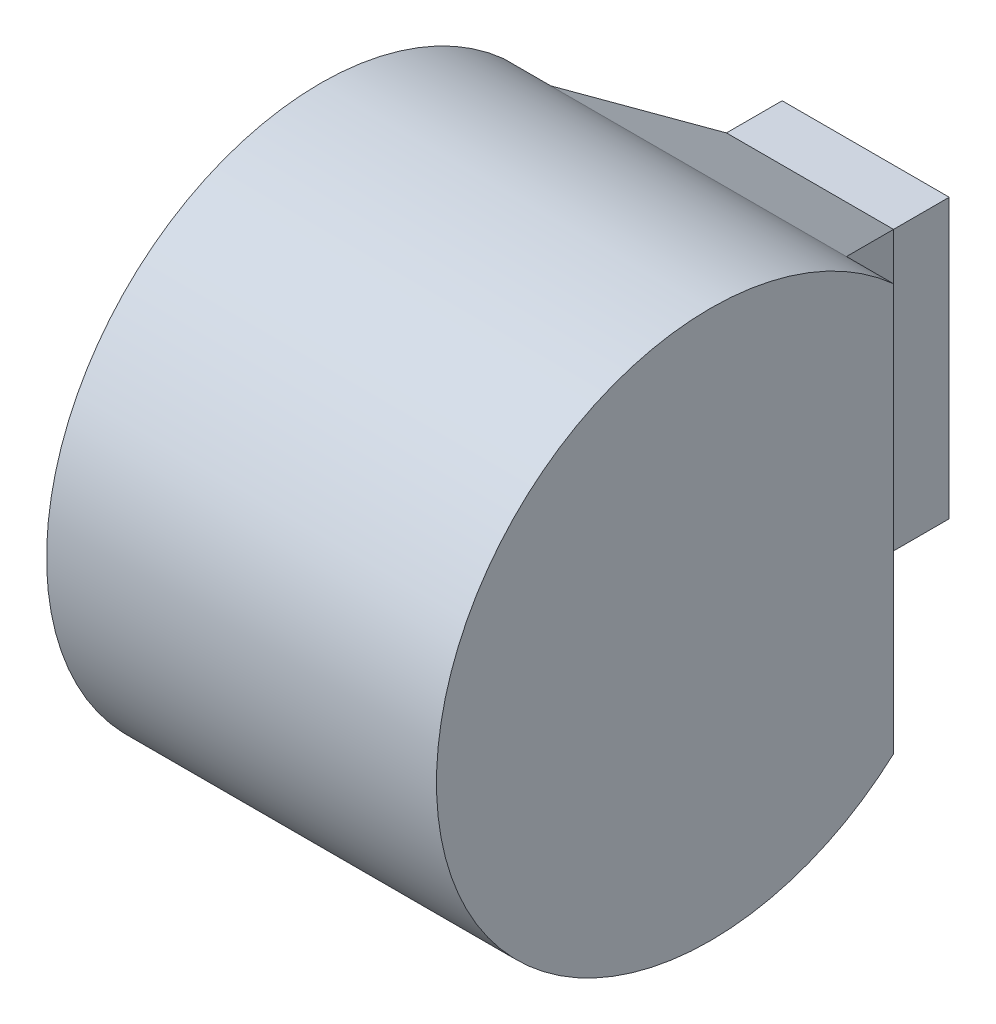
from build123d import *

# Parameters (mm, degrees)
SKETCH_1_W      = 30
SKETCH_1_H      = 50
EXTRUDE_1_DEPTH = 10
SKETCH_2_W      = 30
SKETCH_2_H      = 50
EXTRUDE_2_DEPTH = 20
EXTRUDE_2_DRAFT = -30
EXTRUDE_3_DEPTH = 35


with BuildPart() as part:
    # 草图1 → 凸台-拉伸1 (new body)
    with BuildSketch(Plane.XY):
        Rectangle(SKETCH_1_W, SKETCH_1_H)
    extrude(amount=EXTRUDE_1_DEPTH)


with BuildPart() as extrude_2_tool:
    # 草图2 → 凸台-拉伸2 (with draft: the straight prism first)
    with BuildSketch(Plane.XY.offset(10)):
        Rectangle(SKETCH_2_W, SKETCH_2_H)
    extrude(amount=EXTRUDE_2_DEPTH)
    # 凸台-拉伸2: the draft: its side faces are tilted about the plane it starts from
    extrude_2_sides = [extrude_2_tool.faces().sort_by_distance(p)[0] for p in [
        (15, 0, 20),
        (0, 25, 20),
        (-15, 0, 20),
        (0, -25, 20),
    ]]
    draft(extrude_2_sides, Plane.XY.offset(10), EXTRUDE_2_DRAFT)


with BuildPart() as part_1:
    add(part.part)

    # 凸台-拉伸2: add extrude_2_tool
    add(extrude_2_tool.part)

    # 草图3 → 凸台-拉伸3 (add, symmetric)
    with BuildSketch(Plane(origin=(0, 0, 0), x_dir=(0, 0, -1), z_dir=(1, 0, 0))):
        with BuildLine():
            Line((-30, 36.547005384), (-30, -36.547005384))
            ThreePointArc((-30, -36.547005384), (-112.063957994, 0), (-30, 36.547005384))
        make_face()
    extrude(amount=EXTRUDE_3_DEPTH, both=True)


solid = part_1.part
